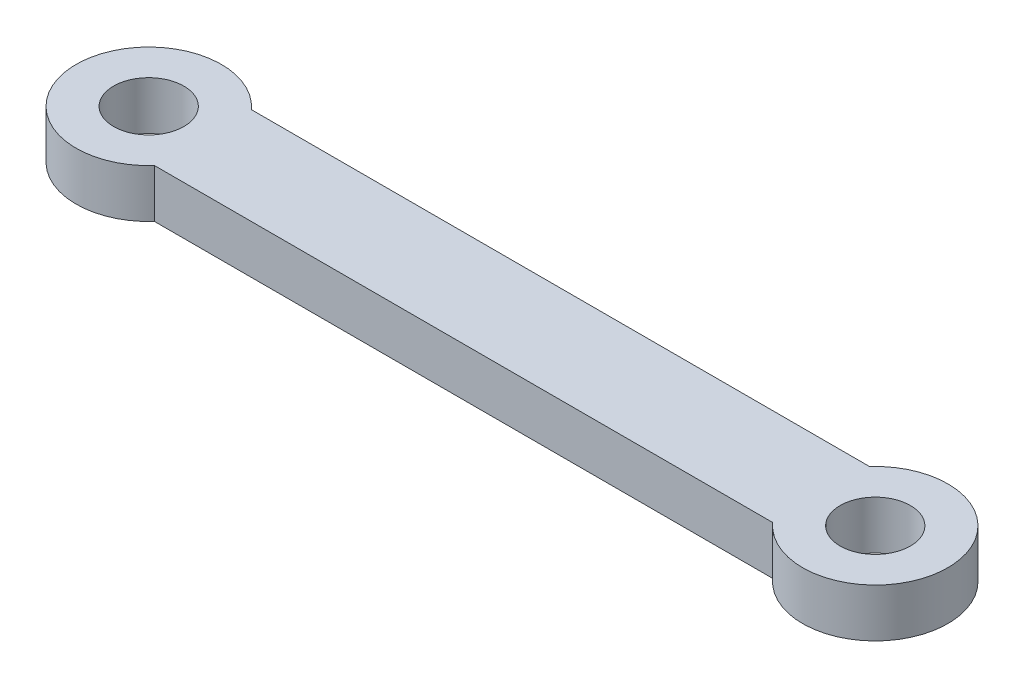
from build123d import *

# Parameters (mm, degrees)
SALIENTE_EXTRUIR1_DEPTH = 2
CROQUIS_BARRENOS_R      = 1.45
CORTAR_EXTRUIR1_DEPTH   = 2


with BuildPart() as part:
    # Croquis base → Saliente-Extruir1 (new body)
    with BuildSketch(Plane(origin=(0, 0, 0), x_dir=(1, 0, 0), z_dir=(0, 1, 0))):
        with BuildLine():
            Line((12.763932023, 2), (-12.763932023, 2))
            ThreePointArc((-12.763932023, 2), (-13.775255129, 2.738612788), (-15, 3))
            ThreePointArc((-15, 3), (-18, 0), (-15, -3))
            ThreePointArc((-15, -3), (-13.775255129, -2.738612788), (-12.763932023, -2))
            Line((-12.763932023, -2), (12.763932023, -2))
            ThreePointArc((12.763932023, -2), (13.775255129, -2.738612788), (15, -3))
            ThreePointArc((15, -3), (18, 0), (15, 3))
            ThreePointArc((15, 3), (13.775255129, 2.738612788), (12.763932023, 2))
        make_face()
    extrude(amount=SALIENTE_EXTRUIR1_DEPTH)

    # Croquis barrenos → Cortar-Extruir1 (cut)
    with BuildSketch(Plane(origin=(0, 2, 0), x_dir=(1, 0, 0), z_dir=(0, 1, 0))):
        with Locations(Location((-15, 0, 0), (0, 0, 270))):
            Circle(CROQUIS_BARRENOS_R)
        with Locations(Location((15, 0, 0), (0, 0, 270))):
            Circle(CROQUIS_BARRENOS_R)
    extrude(amount=-CORTAR_EXTRUIR1_DEPTH, mode=Mode.SUBTRACT)


solid = part.part
